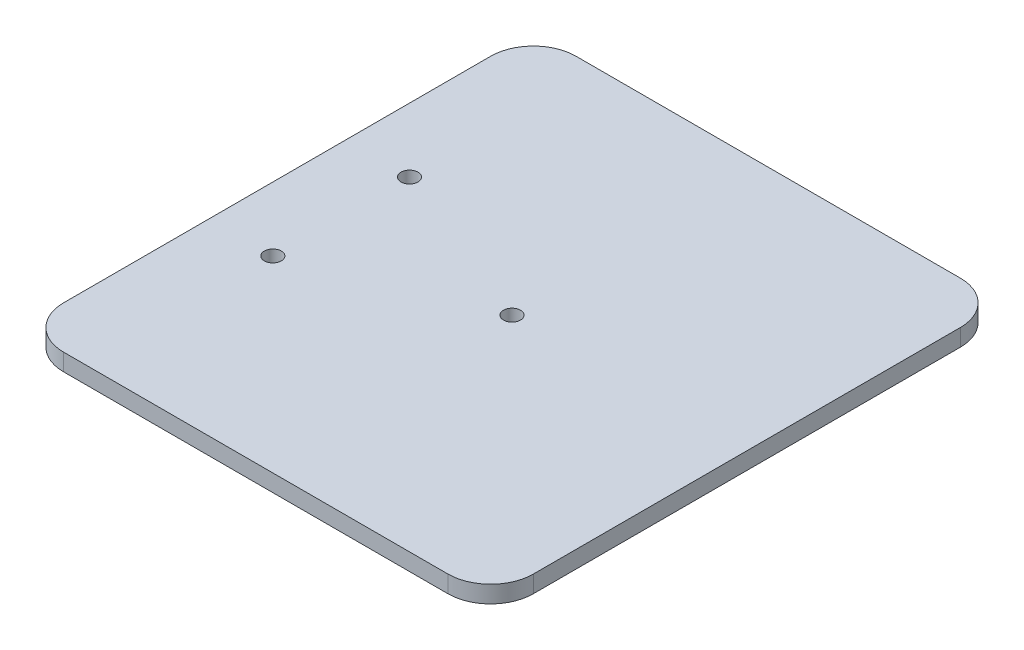
from build123d import *

# Parameters (mm, degrees)
SKETCH1_R           = 1
BOSS_EXTRUDE1_DEPTH = 2


with BuildPart() as part:
    # Sketch1 → Boss-Extrude1 (new body)
    with BuildSketch(Plane(origin=(0, 0, 0), x_dir=(1, 0, 0), z_dir=(0, 1, 0))):
        with BuildLine():
            Line((-36.800947867, 29.857819905), (8.199052133, 29.857819905))
            ThreePointArc((8.199052133, 29.857819905), (11.734586039, 28.393353811), (13.199052133, 24.857819905))
            Line((13.199052133, 24.857819905), (13.199052133, -25.142180095))
            ThreePointArc((13.199052133, -25.142180095), (11.734586039, -28.677714001), (8.199052133, -30.142180095))
            Line((8.199052133, -30.142180095), (-36.800947867, -30.142180095))
            ThreePointArc((-36.800947867, -30.142180095), (-40.336481773, -28.677714001), (-41.800947867, -25.142180095))
            Line((-41.800947867, -25.142180095), (-41.800947867, 24.857819905))
            ThreePointArc((-41.800947867, 24.857819905), (-40.336481773, 28.393353811), (-36.800947867, 29.857819905))
        make_face()
        with Locations(Location((-34.300947867, 7.857819905, 0), (0, 0, 270))):
            Circle(SKETCH1_R, mode=Mode.SUBTRACT)
        with Locations(Location((-34.300947867, -8.142180095, 0), (0, 0, 270))):
            Circle(SKETCH1_R, mode=Mode.SUBTRACT)
        with Locations(Location((-14.300947867, -0.142180095, 0), (0, 0, 270))):
            Circle(SKETCH1_R, mode=Mode.SUBTRACT)
    extrude(amount=BOSS_EXTRUDE1_DEPTH)


solid = part.part
